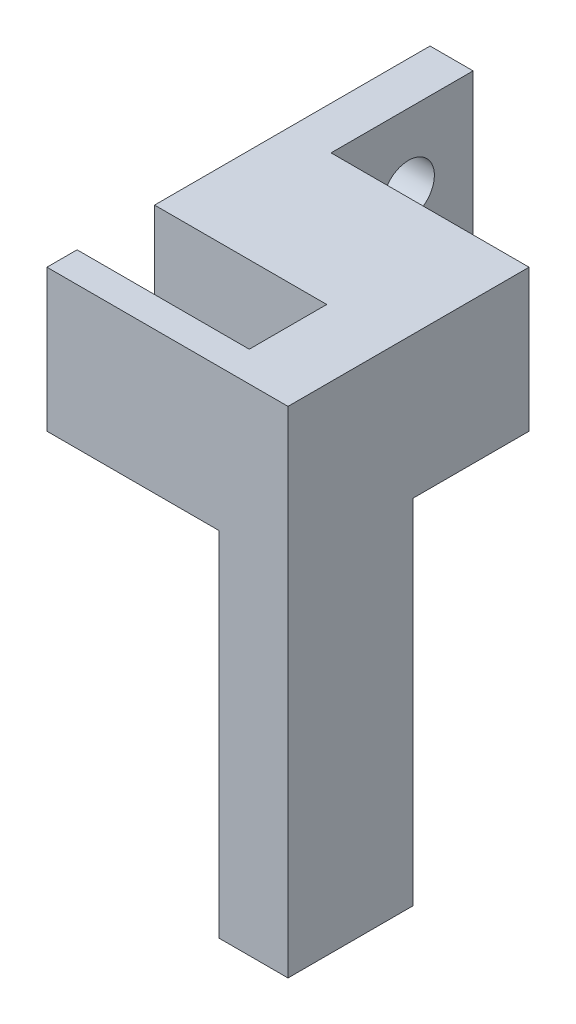
from build123d import *

# Parameters (mm, degrees)
SKETCH_1_W          = 2.9
SKETCH_1_H          = 11.5
EXTRUDE_1_DEPTH     = 1.6
SKETCH_2_W          = 0.7
SKETCH_2_H          = 3.3
SKETCH_2_W_2        = 0.4
EXTRUDE_2_DEPTH     = 4
SKETCH_3_W          = 5.6
SKETCH_3_H          = 3.3
EXTRUDE_3_DEPTH     = 3
SKETCH_4_W          = 1
SKETCH_4_H          = 3.3
EXTRUDE_4_DEPTH     = 3
SKETCH_5_R          = 0.6
CUT_EXTRUDE_1_DEPTH = 14.762630563
SKETCH_6_W          = 4.6
SKETCH_6_H          = 3.3
CUT_EXTRUDE_2_DEPTH = 0.3


with BuildPart() as part:
    # 草图1 → 凸台-拉伸1 (new body)
    with BuildSketch(Plane(origin=(0, 0, 0), x_dir=(0, 0, -1), z_dir=(1, 0, 0))):
        with Locations((-1.45, -5.75)):
            Rectangle(SKETCH_1_W, SKETCH_1_H)
    extrude(amount=EXTRUDE_1_DEPTH)

    # 草图2 → 凸台-拉伸2 (add)
    with BuildSketch(Plane.ZY):
        with Locations((2.55, -1.65)):
            Rectangle(SKETCH_2_W, SKETCH_2_H)
        with Locations((0.2, -1.65)):
            Rectangle(SKETCH_2_W_2, SKETCH_2_H)
    extrude(amount=EXTRUDE_2_DEPTH)

    # 草图3 → 凸台-拉伸3 (add)
    with BuildSketch(Plane(origin=(0, 0, 0), x_dir=(-1, 0, 0), z_dir=(0, 0, -1))):
        with Locations((1.2, -1.65)):
            Rectangle(SKETCH_3_W, SKETCH_3_H)
    extrude(amount=EXTRUDE_3_DEPTH)

    # 草图4 → 凸台-拉伸4 (add)
    with BuildSketch(Plane(origin=(0, 0, -3), x_dir=(-1, 0, 0), z_dir=(0, 0, -1))):
        with Locations((3.5, -1.65)):
            Rectangle(SKETCH_4_W, SKETCH_4_H)
    extrude(amount=EXTRUDE_4_DEPTH)

    # 草图5 → 切除-拉伸1 (cut, through all)
    with BuildSketch(Plane(origin=(-3, 0, 0), x_dir=(0, 0, -1), z_dir=(1, 0, 0))):
        with Locations(Location((4.5, -1.65, 0), (0, 0, 90))):
            Circle(SKETCH_5_R)
    extrude(amount=-CUT_EXTRUDE_1_DEPTH, mode=Mode.SUBTRACT)

    # 草图6 → 切除-拉伸2 (cut)
    with BuildSketch(Plane(origin=(0, 0, -3), x_dir=(-1, 0, 0), z_dir=(0, 0, -1))):
        with Locations((0.7, -1.65)):
            Rectangle(SKETCH_6_W, SKETCH_6_H)
    extrude(amount=-CUT_EXTRUDE_2_DEPTH, mode=Mode.SUBTRACT)


solid = part.part
